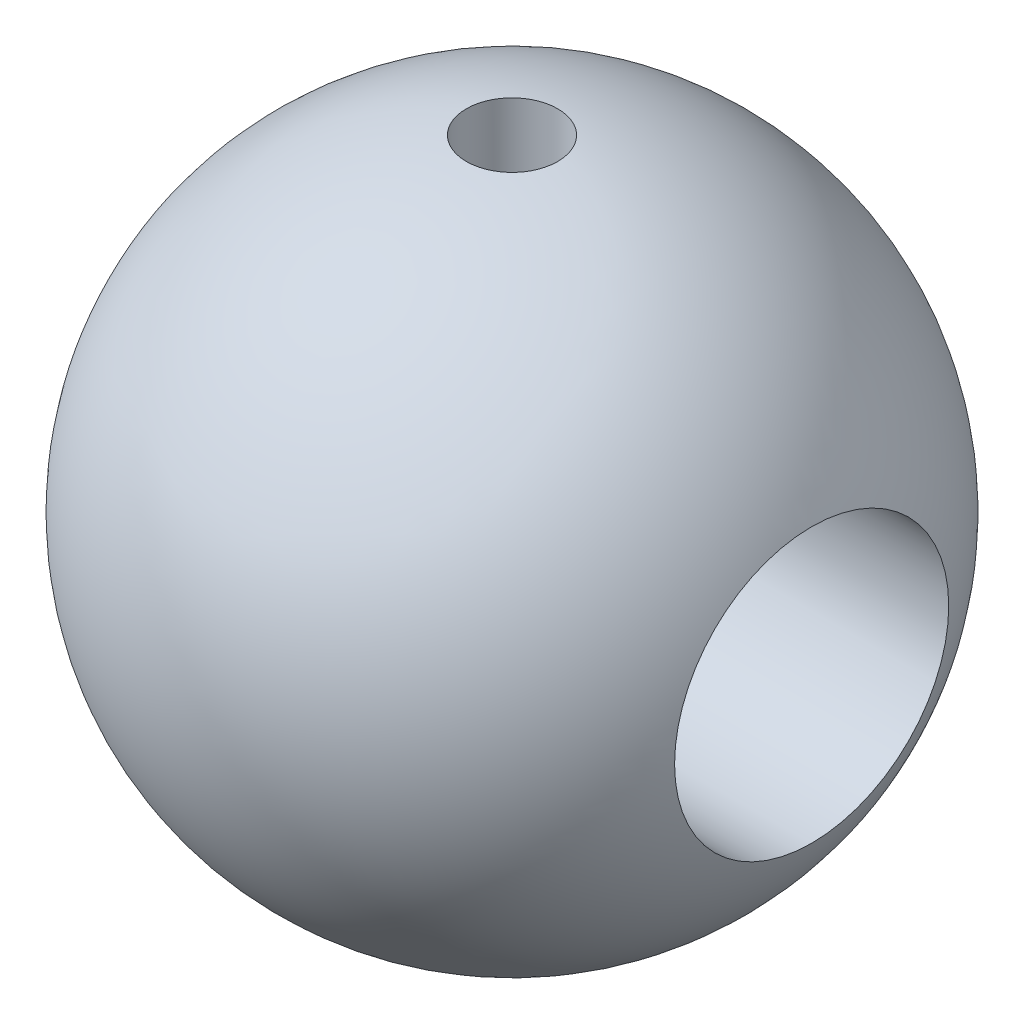
from build123d import *

# Parameters (mm, degrees)
CUT_EXTRUDE1_REACH             = 18.498
SKETCH2_R                      = 3.9624
CUT_EXTRUDE1_DIRECTION_2_REACH = 18.498
F_37_0_104_DIAMETER_HOLE1_D    = 2.6416


with BuildPart() as part:
    # Sketch1 → Revolve1 (revolve)
    with BuildSketch(Plane.XY):
        with BuildLine():
            Line((-9.525, 0), (9.525, 0))
            ThreePointArc((9.525, 0), (0, 9.525), (-9.525, 0))
        make_face()
    revolve(axis=Axis((-12.682244361, 0, 0), (1, 0, 0)))

    # Sketch2 → Cut-Extrude1 (cut, up to next)
    with BuildSketch(Plane(origin=(0, 0, 0), x_dir=(0, 0, -1), z_dir=(1, 0, 0)), mode=Mode.PRIVATE) as cut_extrude1_sk1:
        with Locations(Location((0, 0, 0), (0, 0, 90))):
            Circle(SKETCH2_R)
    cut_extrude1_tool1 = extrude(cut_extrude1_sk1.sketch, amount=-CUT_EXTRUDE1_REACH, mode=Mode.PRIVATE) & part.part
    add(cut_extrude1_tool1.solids().sort_by_distance((0, 0, 0))[0], mode=Mode.SUBTRACT)

    # Sketch2 → Cut-Extrude1 direction 2 (cut, up to next)
    with BuildSketch(Plane(origin=(0, 0, 0), x_dir=(0, 0, -1), z_dir=(1, 0, 0)), mode=Mode.PRIVATE) as cut_extrude1_direction_2_sk1:
        with Locations(Location((0, 0, 0), (0, 0, 90))):
            Circle(SKETCH2_R)
    cut_extrude1_direction_2_tool1 = extrude(cut_extrude1_direction_2_sk1.sketch, amount=CUT_EXTRUDE1_DIRECTION_2_REACH, mode=Mode.PRIVATE) & part.part
    add(cut_extrude1_direction_2_tool1.solids().sort_by_distance((0, 0, 0))[0], mode=Mode.SUBTRACT)

    # #37 (0.104) Diameter Hole1 (through all)
    with Locations(Plane(origin=(0, 9.525, 0), x_dir=(1, 0, 0), z_dir=(0, 1, 0))):
        with Locations((0, 0)):
            Hole(F_37_0_104_DIAMETER_HOLE1_D / 2)


solid = part.part
